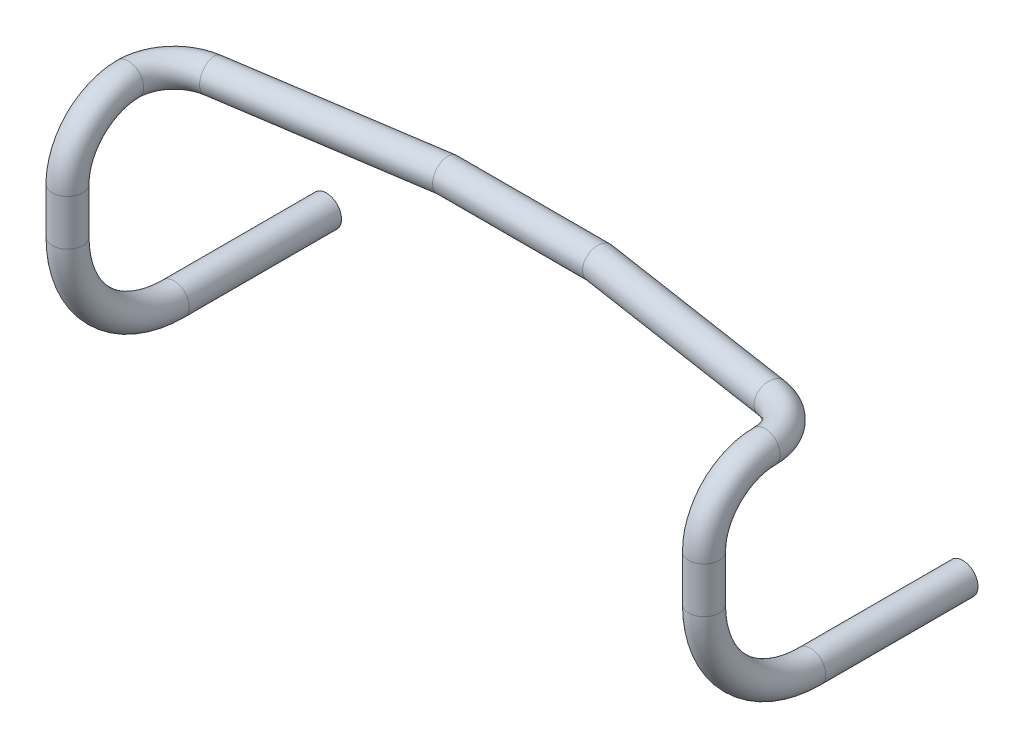
from build123d import *

# Parameters (mm, degrees)
SKETCH1_R = 10


with BuildPart() as part:
    # Sweep1: sweep along a curve in space
    with BuildLine() as sweep1_path:
        Line((209.045449604, -140, 20), (209.045449604, -140, -80))
        ThreePointArc((209.045449604, -70, 90), (209.045449604, -119.497474683, 69.497474683), (209.045449604, -140, 20))
        Line((209.045449604, -40, 90), (209.045449604, -70, 90))
        ThreePointArc((209.045449604, 0, 50), (209.045449604, -11.715728753, 78.284271247), (209.045449604, -40, 90))
        ThreePointArc((183.562460513, 0, 20.342005927), (201.799683575, 0, 30.448917259), (209.045449604, 0, 50))
        Line((50, 0, 0), (183.562460513, 0, 20.342005927))
        Line((-50, 0, 0), (50, 0, 0))
        Line((-50, 0, 0), (-183.562460513, 0, 20.342005927))
        ThreePointArc((-209.045449604, 0, 50), (-201.799683575, 0, 30.448917259), (-183.562460513, 0, 20.342005927))
        ThreePointArc((-209.045449604, -40, 90), (-209.045449604, -11.715728753, 78.284271247), (-209.045449604, 0, 50))
        Line((-209.045449604, -40, 90), (-209.045449604, -70, 90))
        ThreePointArc((-209.045449604, -140, 20), (-209.045449604, -119.497474683, 69.497474683), (-209.045449604, -70, 90))
        Line((-209.045449604, -140, 20), (-209.045449604, -140, -80))
    # Sketch1 → Sweep1 (sweep)
    with BuildSketch(Plane.XY.offset(-80)):
        with Locations((-209.045449604, -140)):
            Circle(SKETCH1_R)
    sweep(path=sweep1_path.line, transition=Transition.RIGHT)


solid = part.part
